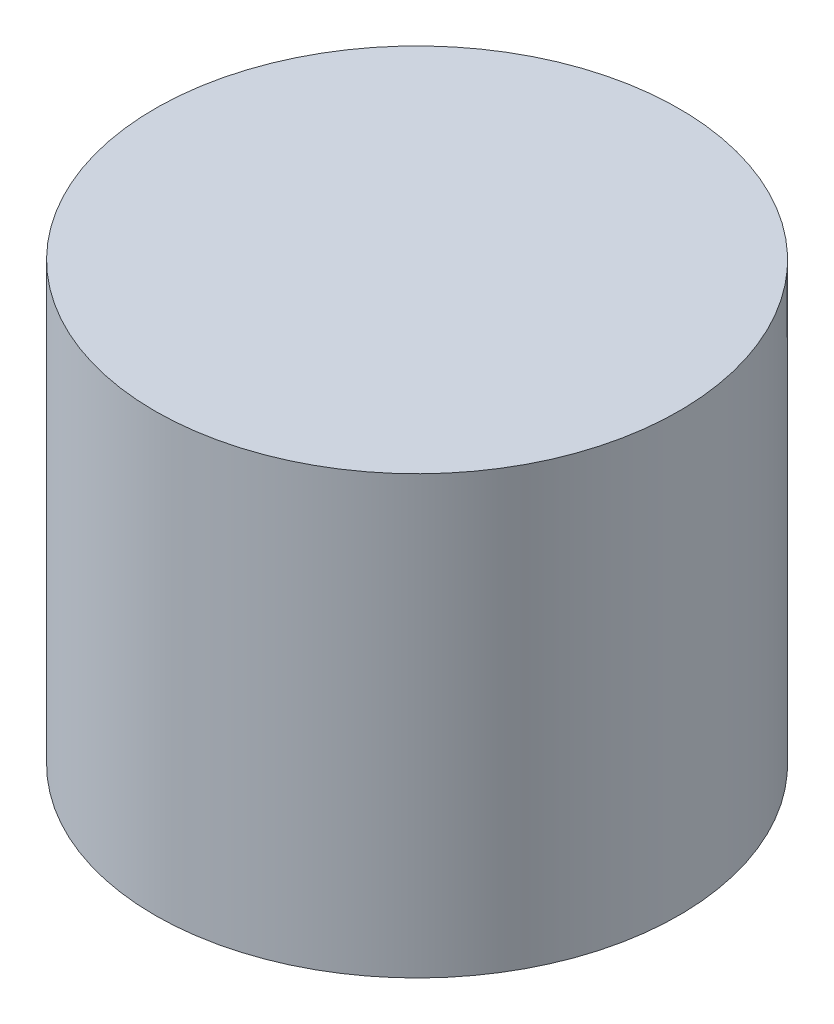
from build123d import *

# Parameters (mm, degrees)
SKETCH1_R           = 19.05
SKETCH1_R_2         = 12.7
BOSS_EXTRUDE1_DEPTH = 25.4
SKETCH4_R           = 19.05
BOSS_EXTRUDE2_DEPTH = 6.35


with BuildPart() as part:
    # Sketch1 → Boss-Extrude1 (new body)
    with BuildSketch(Plane(origin=(0, 0, 0), x_dir=(1, 0, 0), z_dir=(0, 1, 0))):
        with Locations(Location((0, 0, 0), (0, 0, 270))):
            Circle(SKETCH1_R)
        with Locations(Location((0, 0, 0), (0, 0, 270))):
            Circle(SKETCH1_R_2, mode=Mode.SUBTRACT)
    extrude(amount=BOSS_EXTRUDE1_DEPTH)

    # Sketch4 → Boss-Extrude2 (add)
    with BuildSketch(Plane(origin=(0, 25.4, 0), x_dir=(1, 0, 0), z_dir=(0, 1, 0))):
        with Locations(Location((0, 0, 0), (0, 0, 270))):
            Circle(SKETCH4_R)
    extrude(amount=BOSS_EXTRUDE2_DEPTH)


solid = part.part
